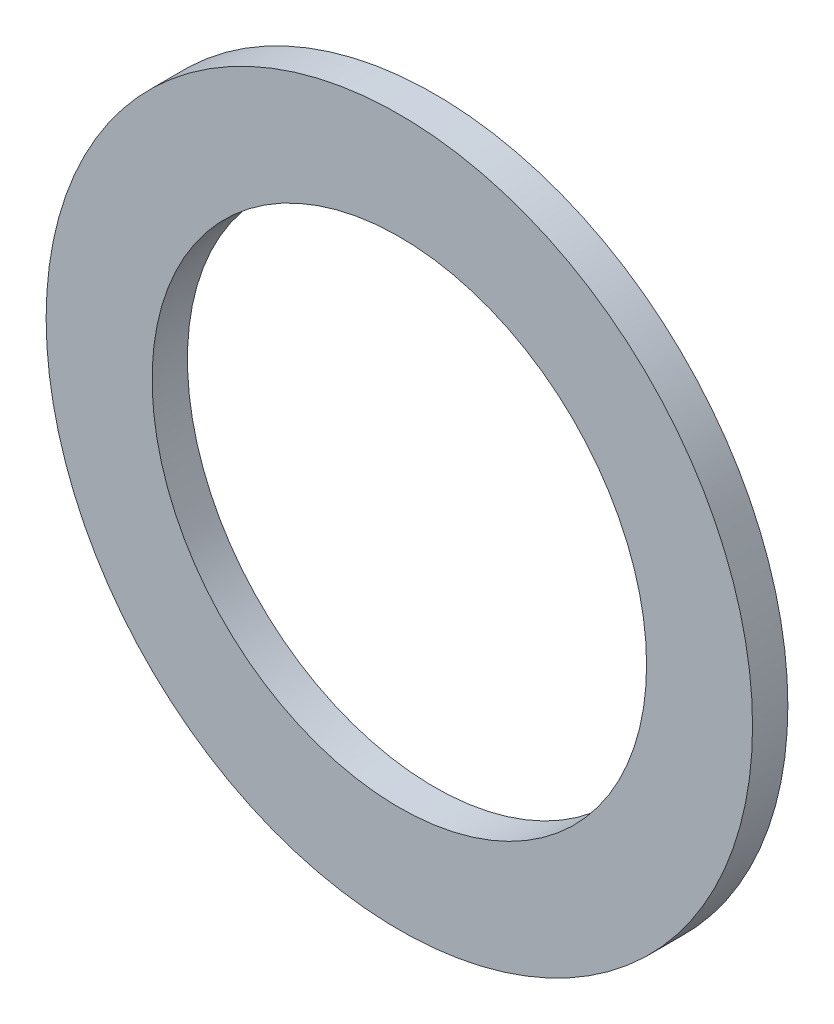
from build123d import *

# Parameters (mm, degrees)
SKETCH_1_R      = 5
SKETCH_1_R_2    = 3.5
EXTRUDE_1_DEPTH = 0.5


with BuildPart() as part:
    # 草图1 → 拉伸1 (new body)
    with BuildSketch(Plane.XY):
        Circle(SKETCH_1_R)
        Circle(SKETCH_1_R_2, mode=Mode.SUBTRACT)
    extrude(amount=EXTRUDE_1_DEPTH)


solid = part.part
